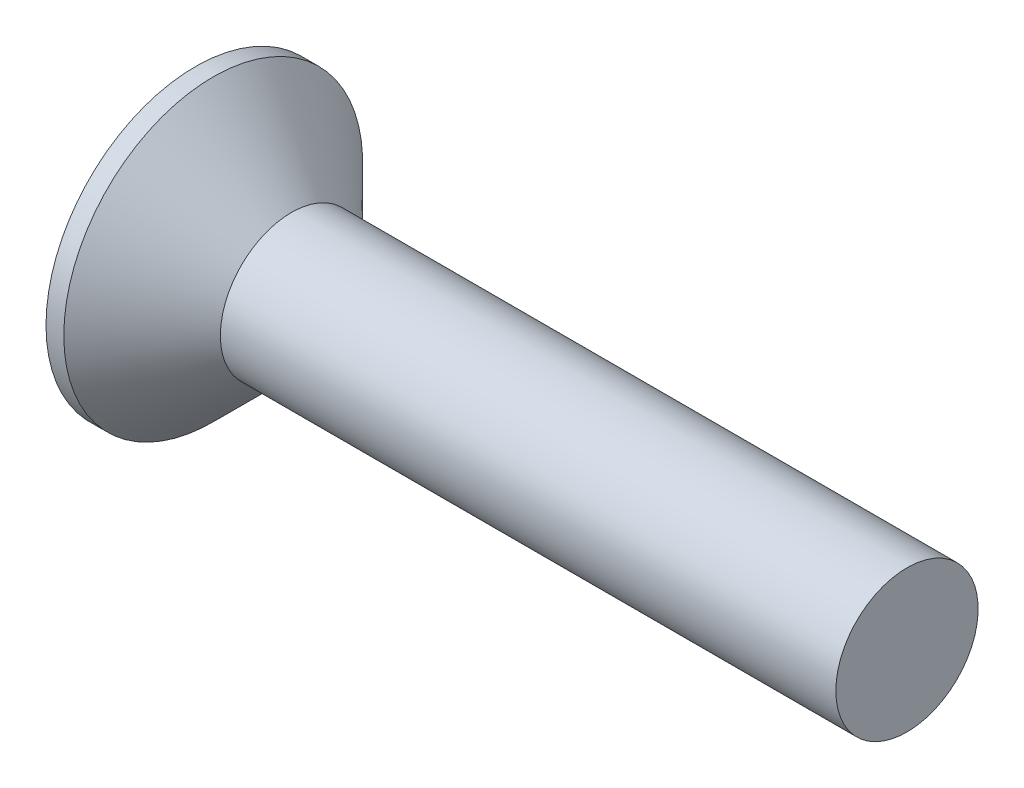
from build123d import *

# Parameters (mm, degrees)
CIRPATTERN1_COUNT = 2
CIRPATTERN1_ANGLE = 90


with BuildPart() as part:
    # BodySke → Base-Revolve (revolve)
    with BuildSketch(Plane.XY, mode=Mode.PRIVATE) as base_revolve_sk:
        Polygon((0, 0), (0, 4.2), (0.5, 4.2), (2.7, 2), (20, 2), (20, 0), align=None)
    revolve(base_revolve_sk.sketch.rotate(Axis((-6.35, 0, 0), (1, 0, 0)), 90), axis=Axis((-6.35, 0, 0), (1, 0, 0)))

    # Sketch3 → Cross section 0
    with BuildSketch(Plane.ZY):
        with BuildLine():
            Line((-0.48, 2.23), (0.48, 2.23))
            Line((0.48, 2.23), (0.48, -2.23))
            Line((0.48, -2.23), (-0.48, -2.23))
            Line((-0.48, -2.23), (-0.48, 2.23))
        make_face()
    # Sketch4 → Cross section 1
    with BuildSketch(Plane.ZY.offset(-2.65)):
        with BuildLine():
            Line((-0.24, 0.24), (0.24, 0.24))
            Line((0.24, 0.24), (0.24, -0.24))
            Line((0.24, -0.24), (-0.24, -0.24))
            Line((-0.24, -0.24), (-0.24, 0.24))
        make_face()
    cross = loft(mode=Mode.SUBTRACT)

    # CirPattern1: Cross ×2 about axis
    cirpattern1_axis = Axis((0, 0, 0), (1, 0, 0))
    for i in range(1, CIRPATTERN1_COUNT):
        add(cross.rotate(cirpattern1_axis, i * CIRPATTERN1_ANGLE / (CIRPATTERN1_COUNT - 1)), mode=Mode.SUBTRACT)


solid = part.part
